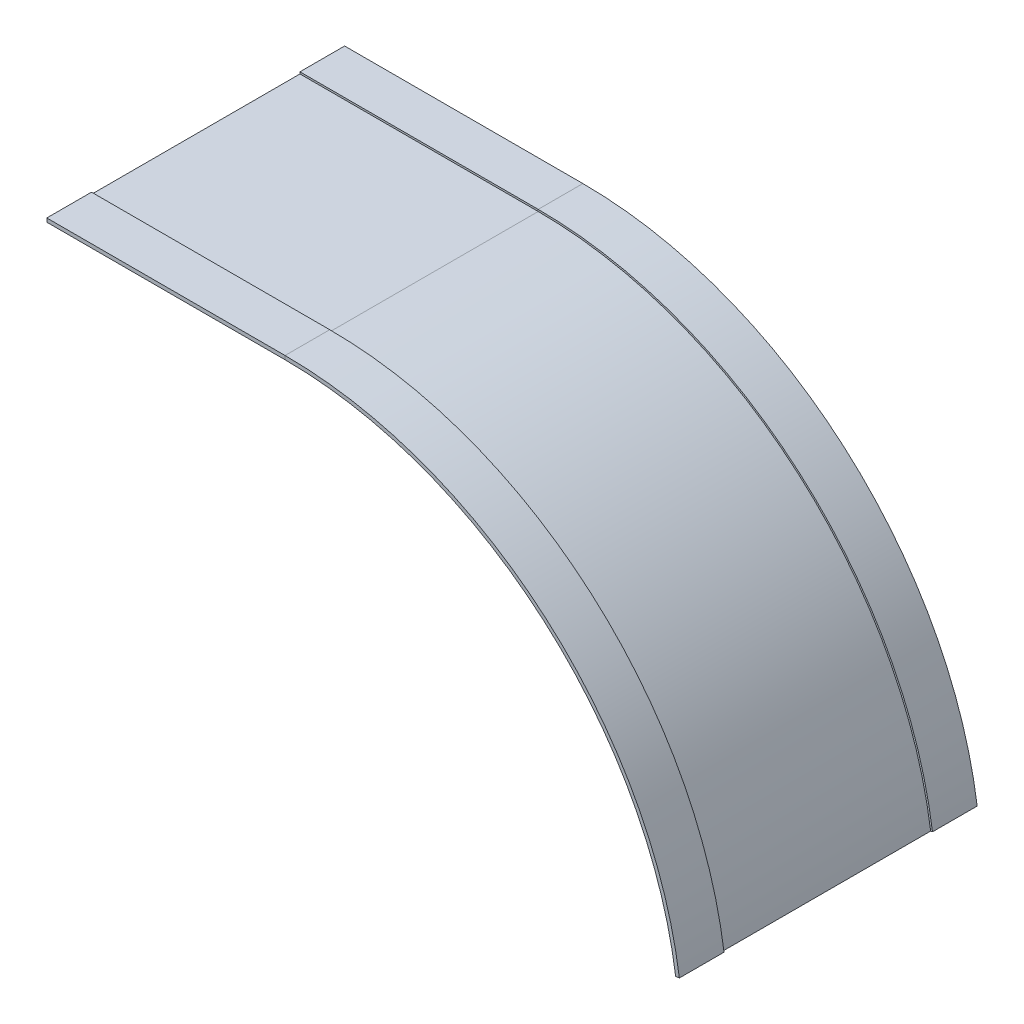
from build123d import *


with BuildPart() as part:
    # Sweep2: sweep along a path in Sketch1
    with BuildLine(Plane.XY) as sweep2_path:
        Line((-190.884848485, 85.898181818), (-89.284848485, 85.898181818))
        ThreePointArc((-89.284848485, 85.898181818), (20.963569163, 44.75210076), (77.296784563, -58.564318182))
    # Sketch2 → Sweep2 (sweep)
    with BuildSketch(Plane(origin=(-190.884848485, 0, 0), x_dir=(0, 0, -1), z_dir=(1, 0, 0))):
        Polygon((-63.5, 85.898181818), (63.5, 85.898181818), (63.5, 87.485681818), (44.45, 87.485681818), (44.45, 86.691931818), (-44.45, 86.691931818), (-44.45, 87.485681818), (-63.5, 87.485681818), align=None)
    sweep(path=sweep2_path.line)


solid = part.part
